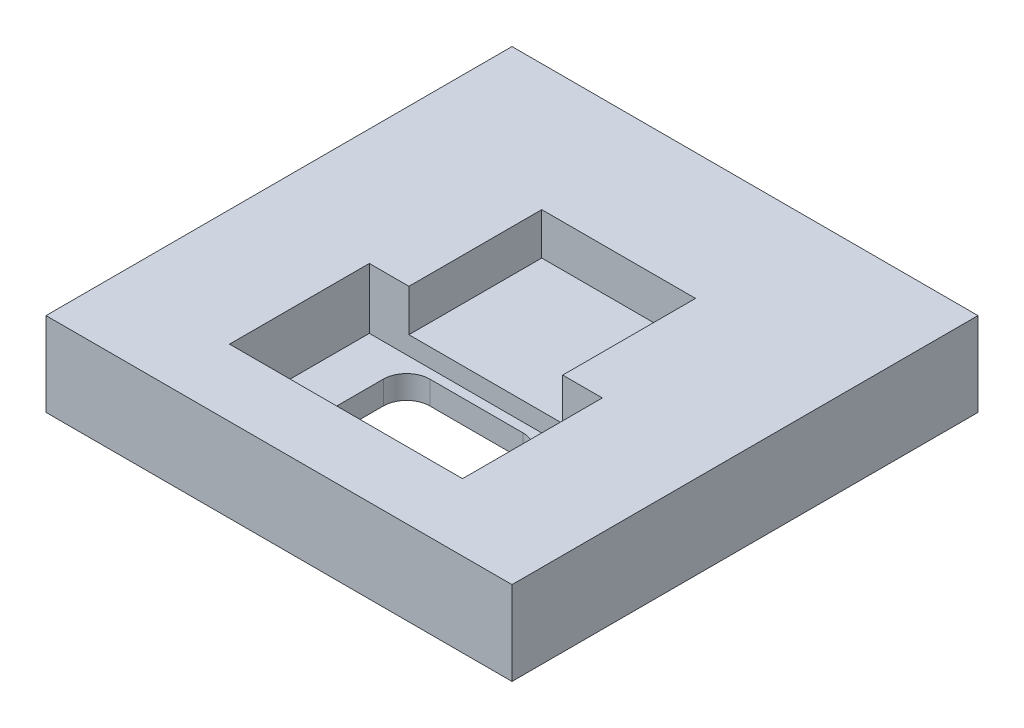
from build123d import *

# Parameters (mm, degrees)
SKETCH_1_W               = 100
SKETCH_1_H               = 100
EXTRUDE_1_DEPTH          = 18
SKETCH_2_W               = 50
SKETCH_2_H               = 30
CUT_EXTRUDE_1_DEPTH      = 13
CUT_EXTRUDE_2_DEPTH      = 72.895757872
CUT_EXTRUDE_2_DEPTH_BACK = 72.895757872
SKETCH_4_W               = 33
SKETCH_4_H               = 28.5
CUT_EXTRUDE_3_DEPTH      = 9


with BuildPart() as part:
    # Эскиз1 → Бобышка-Вытянуть1 (new body)
    with BuildSketch(Plane(origin=(0, 0, 0), x_dir=(1, 0, 0), z_dir=(0, 1, 0))):
        Rectangle(SKETCH_1_W, SKETCH_1_H)
    extrude(amount=EXTRUDE_1_DEPTH)

    # Эскиз2 → Вырез-Вытянуть1 (cut)
    with BuildSketch(Plane(origin=(0, 18, 0), x_dir=(1, 0, 0), z_dir=(0, 1, 0))):
        with Locations((0, -20.616579454)):
            Rectangle(SKETCH_2_W, SKETCH_2_H)
    extrude(amount=-CUT_EXTRUDE_1_DEPTH, mode=Mode.SUBTRACT)

    # Эскиз3 → Вырез-Вытянуть2 (cut, two sides: drawn at the far end of the back side and taken through both)
    with BuildSketch(Plane(origin=(0, 5, 0), x_dir=(1, 0, 0), z_dir=(0, 1, 0)).offset(-CUT_EXTRUDE_2_DEPTH_BACK)):
        with BuildLine():
            Line((10, -31.116579454), (-10, -31.116579454))
            ThreePointArc((-10, -31.116579454), (-13.535533906, -29.65211336), (-15, -26.116579454))
            Line((-15, -26.116579454), (-15, -12.616579454))
            ThreePointArc((-15, -12.616579454), (-13.535533906, -9.081045548), (-10, -7.616579454))
            Line((-10, -7.616579454), (10, -7.616579454))
            ThreePointArc((10, -7.616579454), (13.535533906, -9.081045548), (15, -12.616579454))
            Line((15, -12.616579454), (15, -26.116579454))
            ThreePointArc((15, -26.116579454), (13.535533906, -29.65211336), (10, -31.116579454))
        make_face()
    extrude(amount=CUT_EXTRUDE_2_DEPTH + CUT_EXTRUDE_2_DEPTH_BACK, mode=Mode.SUBTRACT)

    # Эскиз4 → Вырез-Вытянуть3 (cut)
    with BuildSketch(Plane(origin=(0, 18, 0), x_dir=(1, 0, 0), z_dir=(0, 1, 0))):
        with Locations((0, 8.633420546)):
            Rectangle(SKETCH_4_W, SKETCH_4_H)
    extrude(amount=-CUT_EXTRUDE_3_DEPTH, mode=Mode.SUBTRACT)


solid = part.part
